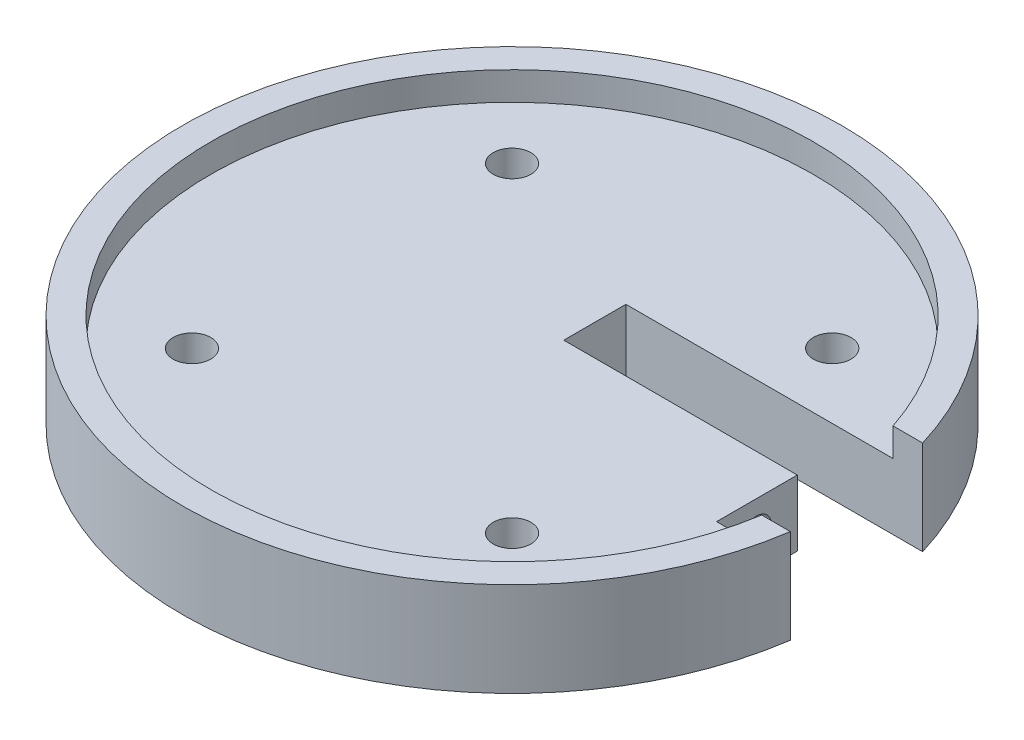
from build123d import *

# Parameters (mm, degrees)
SKETCH1_R               = 35
BOSS_EXTRUDE1_DEPTH     = 10
SKETCH27_W              = 8.45046724
SKETCH27_H              = 8.572937779
CUT_EXTRUDE8_DEPTH      = 51.497524692
CUT_EXTRUDE9_DEPTH      = 51.497524692
CUT_EXTRUDE9_DEPTH_BACK = 51.497524692
SKETCH34_R              = 2
SKETCH35_R              = 2
CUT_EXTRUDE10_DEPTH     = 51.497524692
SKETCH36_R              = 2
CUT_EXTRUDE11_DEPTH     = 51.497524692
SKETCH37_R              = 2
CUT_EXTRUDE12_DEPTH     = 51.497524692
SKETCH39_R              = 32
CUT_EXTRUDE14_DEPTH     = 3
SKETCH40_R              = 1.6
CUT_EXTRUDE16_DEPTH     = 35
SKETCH49_W              = 3
SKETCH49_H              = 26.802326962
CUT_EXTRUDE18_DEPTH     = 51.49752485


with BuildPart() as part:
    # Sketch1 → Boss-Extrude1 (new body)
    with BuildSketch(Plane(origin=(0, 0, 0), x_dir=(1, 0, 0), z_dir=(0, 1, 0))):
        with Locations(Location((0, 0, 0), (0, 0, 270))):
            Circle(SKETCH1_R)
    extrude(amount=BOSS_EXTRUDE1_DEPTH)

    # Sketch27 → Cut-Extrude8 (cut, through all)
    with BuildSketch(Plane(origin=(0, 10, 0), x_dir=(1, 0, 0), z_dir=(0, 1, 0))):
        with Locations((31.027560582, -0.794372815)):
            Rectangle(SKETCH27_W, SKETCH27_H)
    extrude(amount=-CUT_EXTRUDE8_DEPTH, mode=Mode.SUBTRACT)

    # Sketch34 → Cut-Extrude9 (cut, two sides: drawn at the far end of the back side and taken through both)
    with BuildSketch(Plane(origin=(0, 10, 0), x_dir=(1, 0, 0), z_dir=(0, 1, 0)).offset(-CUT_EXTRUDE9_DEPTH_BACK)):
        with Locations(Location((-17, 17, 0), (0, 0, 270))):
            Circle(SKETCH34_R)
    extrude(amount=CUT_EXTRUDE9_DEPTH + CUT_EXTRUDE9_DEPTH_BACK, mode=Mode.SUBTRACT)

    # Sketch35 → Cut-Extrude10 (cut, through all)
    with BuildSketch(Plane(origin=(0, 0, 0), x_dir=(-1, 0, 0), z_dir=(0, -1, 0))):
        with Locations(Location((-17, 17, 0), (0, 0, 90))):
            Circle(SKETCH35_R)
    extrude(amount=-CUT_EXTRUDE10_DEPTH, mode=Mode.SUBTRACT)

    # Sketch36 → Cut-Extrude11 (cut, through all)
    with BuildSketch(Plane(origin=(0, 0, 0), x_dir=(-1, 0, 0), z_dir=(0, -1, 0))):
        with Locations(Location((17, -17, 0), (0, 0, 90))):
            Circle(SKETCH36_R)
    extrude(amount=-CUT_EXTRUDE11_DEPTH, mode=Mode.SUBTRACT)

    # Sketch37 → Cut-Extrude12 (cut, through all)
    with BuildSketch(Plane.XZ):
        with Locations(Location((17, 17, 0), (0, 0, 270))):
            Circle(SKETCH37_R)
    extrude(amount=-CUT_EXTRUDE12_DEPTH, mode=Mode.SUBTRACT)

    # Sketch39 → Cut-Extrude14 (cut)
    with BuildSketch(Plane(origin=(0, 10, 0), x_dir=(1, 0, 0), z_dir=(0, 1, 0))):
        Circle(SKETCH39_R)
    extrude(amount=-CUT_EXTRUDE14_DEPTH, mode=Mode.SUBTRACT)

    # Sketch40 → Cut-Extrude16 (cut)
    with BuildSketch(Plane(origin=(26.802326962, 0, 0), x_dir=(0, 0, -1), z_dir=(1, 0, 0))):
        with Locations((-0.847360281, 3.801055622)):
            Circle(SKETCH40_R)
    extrude(amount=-CUT_EXTRUDE16_DEPTH, mode=Mode.SUBTRACT)

    # Sketch49 → Ø6.0mm Dowel Hole6 (revolve, cut)
    with BuildSketch(Plane(origin=(-8.197673038, 3.801055622, 0.847360281), x_dir=(0, 0, -1), z_dir=(0, 1, 0))):
        with Locations((1.5, 13.401163481)):
            Rectangle(SKETCH49_W, SKETCH49_H)
    revolve(axis=Axis((-1.847673038, 3.801055622, 0.847360281), (-1, 0, 0)), mode=Mode.SUBTRACT)

    # Sketch52 → Cut-Extrude18 (cut, through all)
    with BuildSketch(Plane(origin=(0, 0, 0), x_dir=(-1, 0, 0), z_dir=(0, -1, 0))):
        Polygon((-26.802326962, 3.492096074), (-1.999842463, 3.492096074), (-1.999842463, 10.092096074), (-33.513424129, 10.092096074), (-39.471976124, 10.092096074), (-42.019310815, 10.092096074), (-42.019310815, 3.492096074), align=None)
    extrude(amount=-CUT_EXTRUDE18_DEPTH, mode=Mode.SUBTRACT)


solid = part.part
